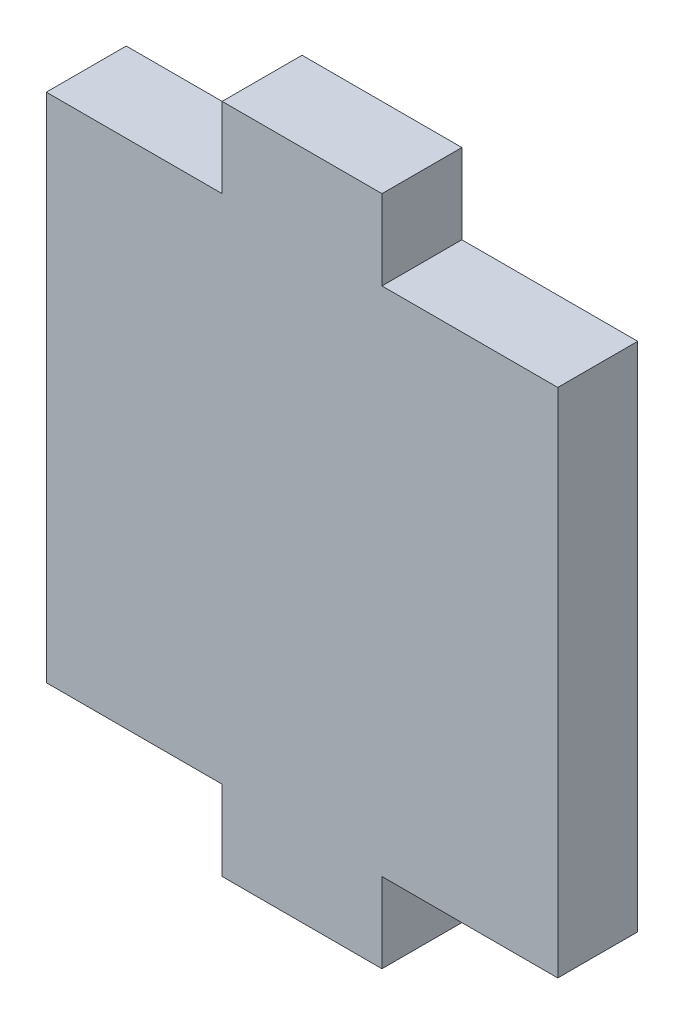
from build123d import *

# Parameters (mm, degrees)
BOSS_EXTRUDE1_DEPTH = 3.175


with BuildPart() as part:
    # Sketch1 → Boss-Extrude1 (new body)
    with BuildSketch(Plane.XY):
        Polygon((-3.175, -10.95375), (-3.175, -14.12875), (3.175, -14.12875), (3.175, -10.95375), (10.16, -10.95375), (10.16, 9.36625), (3.175, 9.36625), (3.175, 12.54125), (-3.175, 12.54125), (-3.175, 9.36625), (-10.16, 9.36625), (-10.16, -10.95375), align=None)
    extrude(amount=BOSS_EXTRUDE1_DEPTH)


solid = part.part
